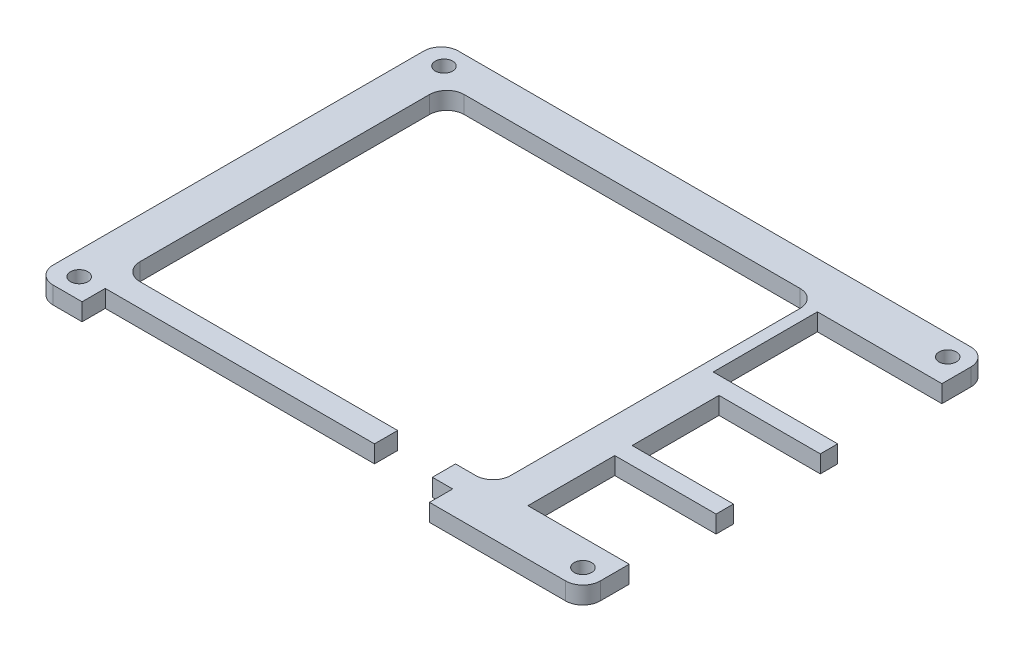
from build123d import *

# Parameters (mm, degrees)
SKETCH1_W           = 94.5
SKETCH1_H           = 70
BOSS_EXTRUDE1_DEPTH = 3
SKETCH3_R           = 1.5
CUT_EXTRUDE2_DEPTH  = 59.877521177
FILLET2_R           = 3
SKETCH5_W           = 64
SKETCH5_H           = 56
SKETCH5_W_2         = 21.5
SKETCH5_H_2         = 18
SKETCH5_W_3         = 17.5
SKETCH5_H_3         = 15
CUT_EXTRUDE3_DEPTH  = 59.877521177
FILLET3_R           = 3


with BuildPart() as part:
    # Sketch1 → Boss-Extrude1 (new body)
    with BuildSketch(Plane(origin=(0, 0, 0), x_dir=(1, 0, 0), z_dir=(0, 1, 0))):
        Rectangle(SKETCH1_W, SKETCH1_H)
    extrude(amount=BOSS_EXTRUDE1_DEPTH)

    # Sketch3 → Cut-Extrude2 (cut, through all)
    with BuildSketch(Plane(origin=(0, 3, 0), x_dir=(1, 0, 0), z_dir=(0, 1, 0))):
        with Locations(Location((43.75, 31.5, 0), (0, 0, 270))):
            Circle(SKETCH3_R)
        with Locations(Location((-43.25, 31.5, 0), (0, 0, 270))):
            Circle(SKETCH3_R)
        with Locations(Location((-43.25, -31.5, 0), (0, 0, 270))):
            Circle(SKETCH3_R)
        with Locations(Location((43.75, -31.5, 0), (0, 0, 270))):
            Circle(SKETCH3_R)
    extrude(amount=-CUT_EXTRUDE2_DEPTH, mode=Mode.SUBTRACT)

    # Fillet2
    fillet2_edges = [part.edges().sort_by_distance(p)[0] for p in [
        (47.25, 1.5, 35),
        (-47.25, 1.5, 35),
        (-47.25, 1.5, -35),
        (47.25, 1.5, -35),
    ]]
    fillet(fillet2_edges, radius=FILLET2_R)

    # Sketch5 → Cut-Extrude3 (cut, through all)
    with BuildSketch(Plane(origin=(0, 3, 0), x_dir=(1, 0, 0), z_dir=(0, 1, 0))):
        with Locations((-8.25, 1)):
            Rectangle(SKETCH5_W, SKETCH5_H)
        with Locations((36.5, 18)):
            Rectangle(SKETCH5_W_2, SKETCH5_H_2)
        with Locations((38.5, -1.5)):
            Rectangle(SKETCH5_W_3, SKETCH5_H_3)
        with Locations((38.5, -19.5)):
            Rectangle(SKETCH5_W_3, SKETCH5_H_3)
        Polygon((17.25, -27), (7.25, -27), (7.25, -31), (-39.25, -31), (-39.25, -35), (20.75, -35), (20.75, -31), (17.25, -31), align=None)
    extrude(amount=-CUT_EXTRUDE3_DEPTH, mode=Mode.SUBTRACT)

    # Fillet3
    fillet3_edges = [part.edges().sort_by_distance(p)[0] for p in [
        (-40.25, 1.5, 27),
        (-40.25, 1.5, -29),
        (23.75, 1.5, -29),
        (23.75, 1.5, 27),
    ]]
    fillet(fillet3_edges, radius=FILLET3_R)


solid = part.part
